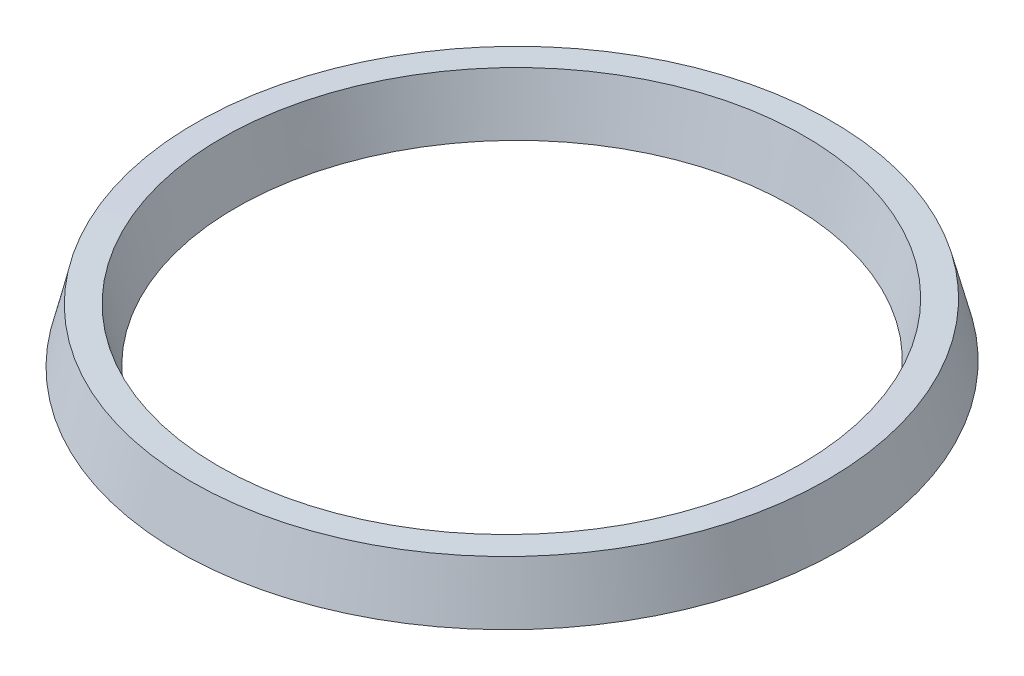
from build123d import *


with BuildPart() as part:
    # Sketch1 → Revolve1 (revolve)
    with BuildSketch(Plane.XY):
        with BuildLine():
            Line((-3, 6), (3, 6))
            Line((3, 6), (6.138790522, -6))
            Line((6.138790522, -6), (3.138790522, -6))
            Line((3.138790522, -6), (1.895185891, -1.245539494))
            ThreePointArc((1.895185891, -1.245539494), (0.063651423, 0.152701363), (-1.737011229, -1.285078181))
            Line((-1.737011229, -1.285078181), (-2.861209478, -6))
            Line((-2.861209478, -6), (-5.861209478, -6))
            Line((-5.861209478, -6), (-3, 6))
        make_face()
    revolve(axis=Axis((-67.767585158, -0.805478429, 0), (-0.011885055906045838, 0.9999293702287728, 0)))


solid = part.part
